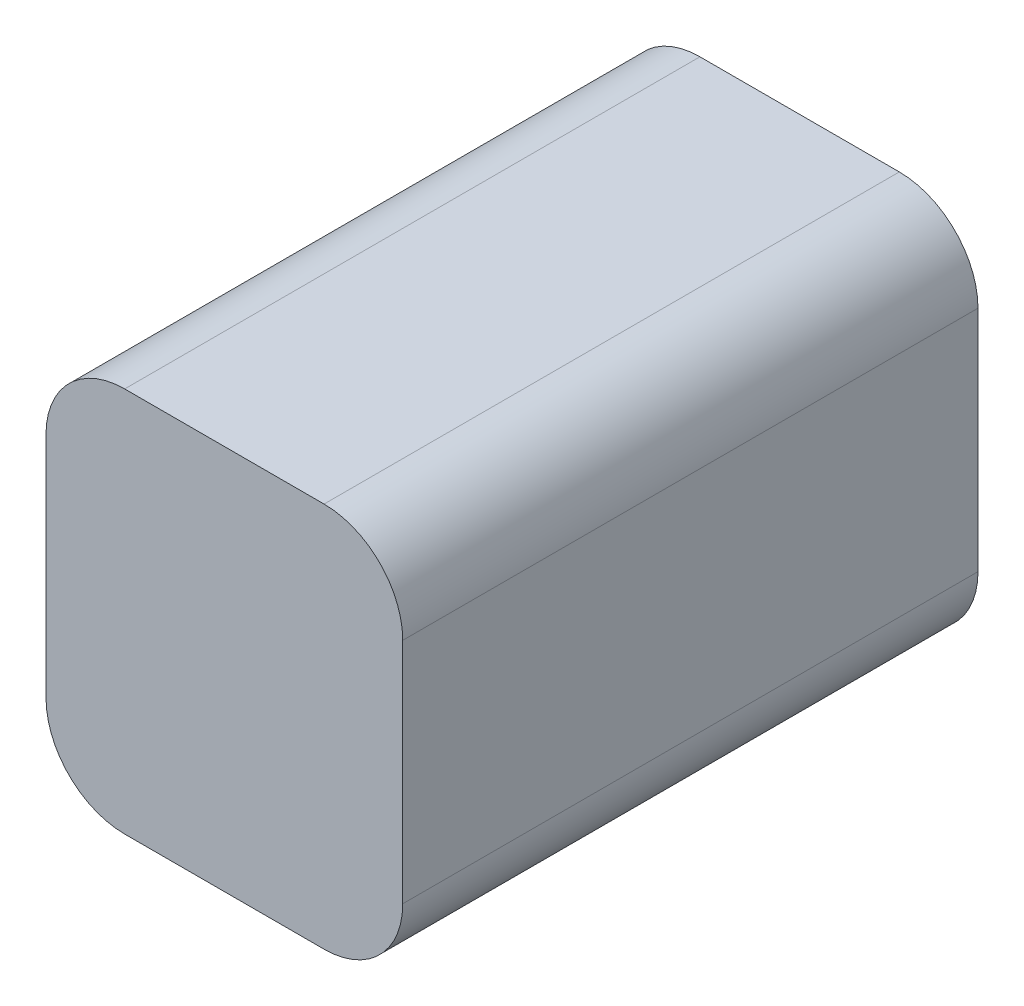
from build123d import *

# Parameters (mm, degrees)
SKETCH1_W           = 42.17
SKETCH1_H           = 45.57
BOSS_EXTRUDE1_DEPTH = 68
FILLET1_R           = 9.3


with BuildPart() as part:
    # Sketch1 → Boss-Extrude1 (new body)
    with BuildSketch(Plane.XY):
        with Locations((1.695, -0.005)):
            Rectangle(SKETCH1_W, SKETCH1_H)
    extrude(amount=BOSS_EXTRUDE1_DEPTH)

    # Fillet1
    fillet1_edges = [part.edges().sort_by_distance(p)[0] for p in [
        (22.78, 22.78, 34),
        (22.78, -22.79, 34),
        (-19.39, -22.79, 34),
        (-19.39, 22.78, 34),
    ]]
    fillet(fillet1_edges, radius=FILLET1_R)


solid = part.part
